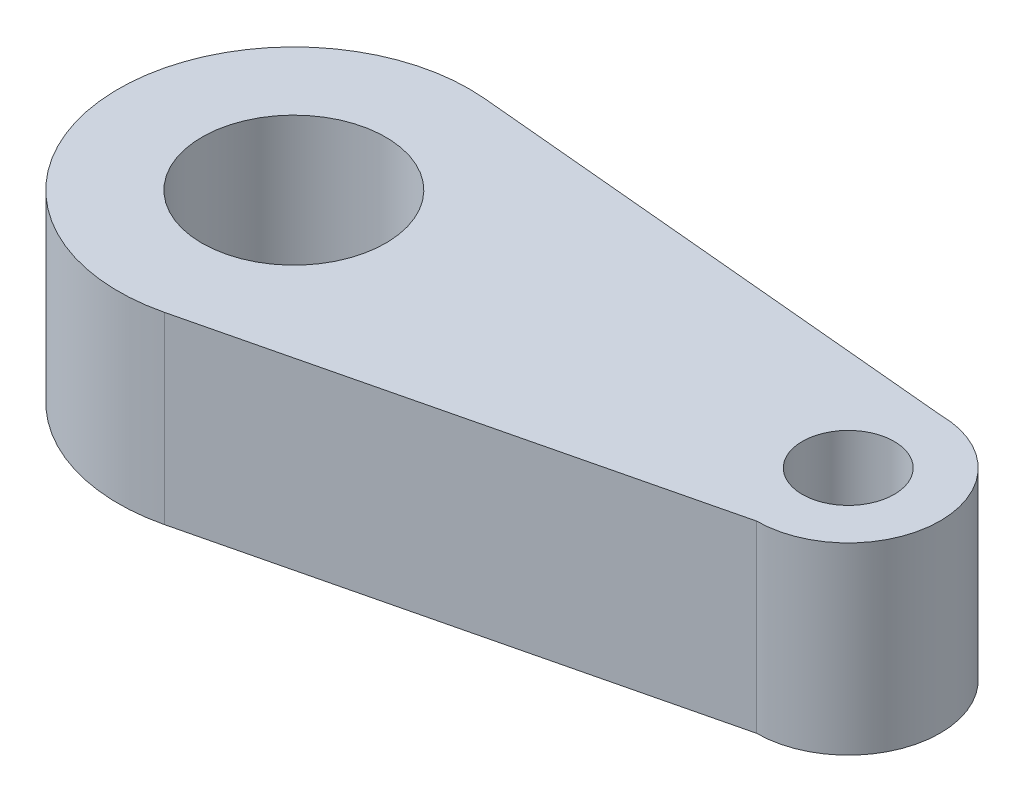
from build123d import *

# Parameters (mm, degrees)
SKETCH1_R           = 1
SKETCH1_R_2         = 2
BOSS_EXTRUDE1_DEPTH = 4


with BuildPart() as part:
    # Sketch1 → Boss-Extrude1 (new body)
    with BuildSketch(Plane(origin=(0, 0, 0), x_dir=(1, 0, 0), z_dir=(0, 1, 0))):
        with BuildLine():
            Line((0, 2), (-10.916533022, 3.003809133))
            ThreePointArc((-10.916533022, 3.003809133), (-15.073248239, -1.075109525), (-10.368699108, -4.507758107))
            Line((-10.368699108, -4.507758107), (0, -2))
            ThreePointArc((0, -2), (2, 0), (0, 2))
        make_face()
        with Locations(Location((0, 0, 0), (0, 0, 270))):
            Circle(SKETCH1_R, mode=Mode.SUBTRACT)
        with Locations(Location((-11.266070083, -0.79744426, 0), (0, 0, 270))):
            Circle(SKETCH1_R_2, mode=Mode.SUBTRACT)
    extrude(amount=BOSS_EXTRUDE1_DEPTH)


solid = part.part
